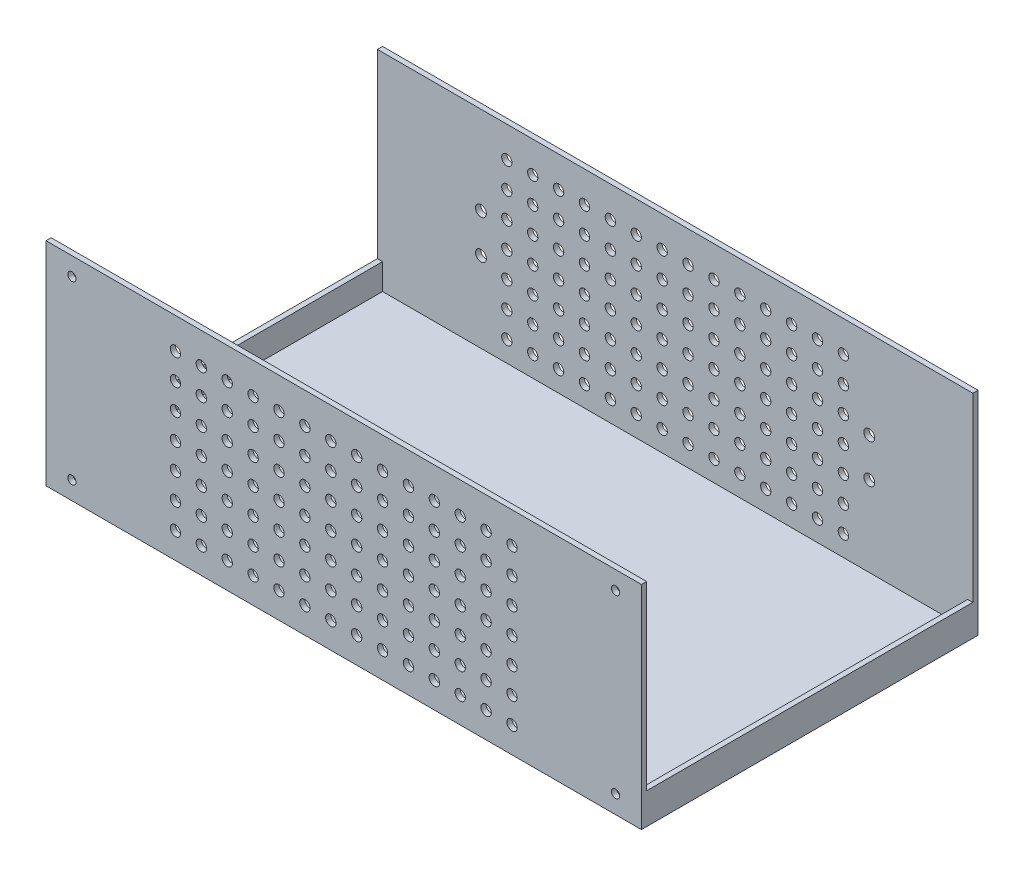
from build123d import *

# Parameters (mm, degrees)
SKETCH_1_W          = 230
SKETCH_1_H          = 130
EXTRUDE_1_DEPTH     = 2
SKETCH_2_W          = 230
SKETCH_2_H          = 130
SKETCH_2_W_2        = 226
SKETCH_2_H_2        = 126
EXTRUDE_2_DEPTH     = 10
SKETCH_3_W          = 230
SKETCH_3_H          = 2
EXTRUDE_3_DEPTH     = 70
SKETCH_4_R          = 3.1
CUT_EXTRUDE_1_DEPTH = 277.043474837
SKETCH_5_R          = 2.1
CUT_EXTRUDE_2_DEPTH = 10
SKETCH_6_R          = 2
CUT_EXTRUDE_3_DEPTH = 277.629716408
SKETCH_7_R          = 1.6
CUT_EXTRUDE_4_DEPTH = 10


with BuildPart() as part:
    # Эскиз1 → Бобышка-Вытянуть1 (new body)
    with BuildSketch(Plane(origin=(0, 0, 0), x_dir=(1, 0, 0), z_dir=(0, 1, 0))):
        with Locations((115, -65)):
            Rectangle(SKETCH_1_W, SKETCH_1_H)
    extrude(amount=EXTRUDE_1_DEPTH)

    # Эскиз2 → Бобышка-Вытянуть2 (add)
    with BuildSketch(Plane(origin=(0, 2, 0), x_dir=(1, 0, 0), z_dir=(0, 1, 0))):
        with Locations((115, -65)):
            Rectangle(SKETCH_2_W, SKETCH_2_H)
        with Locations((115, -65)):
            Rectangle(SKETCH_2_W_2, SKETCH_2_H_2, mode=Mode.SUBTRACT)
    extrude(amount=EXTRUDE_2_DEPTH)

    # Эскиз3 → Бобышка-Вытянуть3 (add)
    with BuildSketch(Plane(origin=(0, 12, 0), x_dir=(1, 0, 0), z_dir=(0, 1, 0))):
        with Locations((115, -1)):
            Rectangle(SKETCH_3_W, SKETCH_3_H)
        with Locations((115, -129)):
            Rectangle(SKETCH_3_W, SKETCH_3_H)
    extrude(amount=EXTRUDE_3_DEPTH)

    # Эскиз4 → Вырез-Вытянуть1 (cut, through all)
    with BuildSketch(Plane(origin=(0, 2, 0), x_dir=(1, 0, 0), z_dir=(0, 1, 0))):
        with Locations((113, -65)):
            Circle(SKETCH_4_R)
    extrude(amount=-CUT_EXTRUDE_1_DEPTH, mode=Mode.SUBTRACT)

    # Эскиз5 → Вырез-Вытянуть2 (cut)
    with BuildSketch(Plane(origin=(0, 0, 0), x_dir=(-1, 0, 0), z_dir=(0, 0, -1))):
        with Locations((-190, 48)):
            Circle(SKETCH_5_R)
        with Locations((-190, 33)):
            Circle(SKETCH_5_R)
        with Locations((-40, 48)):
            Circle(SKETCH_5_R)
        with Locations((-40, 33)):
            Circle(SKETCH_5_R)
    extrude(amount=-CUT_EXTRUDE_2_DEPTH, mode=Mode.SUBTRACT)

    # Эскиз6 → Вырез-Вытянуть3 (cut, through all)
    with BuildSketch(Plane(origin=(0, 0, 0), x_dir=(-1, 0, 0), z_dir=(0, 0, -1))):
        with Locations((-180, 70)):
            Circle(SKETCH_6_R)
        with Locations((-170, 70)):
            Circle(SKETCH_6_R)
        with Locations((-160, 70)):
            Circle(SKETCH_6_R)
        with Locations((-150, 70)):
            Circle(SKETCH_6_R)
        with Locations((-140, 70)):
            Circle(SKETCH_6_R)
        with Locations((-130, 70)):
            Circle(SKETCH_6_R)
        with Locations((-120, 70)):
            Circle(SKETCH_6_R)
        with Locations((-110, 70)):
            Circle(SKETCH_6_R)
        with Locations((-100, 70)):
            Circle(SKETCH_6_R)
        with Locations((-90, 70)):
            Circle(SKETCH_6_R)
        with Locations((-80, 70)):
            Circle(SKETCH_6_R)
        with Locations((-70, 70)):
            Circle(SKETCH_6_R)
        with Locations((-60, 70)):
            Circle(SKETCH_6_R)
        with Locations((-50, 70)):
            Circle(SKETCH_6_R)
        with Locations((-170, 60)):
            Circle(SKETCH_6_R)
        with Locations((-160, 60)):
            Circle(SKETCH_6_R)
        with Locations((-150, 60)):
            Circle(SKETCH_6_R)
        with Locations((-140, 60)):
            Circle(SKETCH_6_R)
        with Locations((-130, 60)):
            Circle(SKETCH_6_R)
        with Locations((-120, 60)):
            Circle(SKETCH_6_R)
        with Locations((-110, 60)):
            Circle(SKETCH_6_R)
        with Locations((-100, 60)):
            Circle(SKETCH_6_R)
        with Locations((-90, 60)):
            Circle(SKETCH_6_R)
        with Locations((-80, 60)):
            Circle(SKETCH_6_R)
        with Locations((-70, 60)):
            Circle(SKETCH_6_R)
        with Locations((-60, 60)):
            Circle(SKETCH_6_R)
        with Locations((-50, 60)):
            Circle(SKETCH_6_R)
        with Locations((-170, 50)):
            Circle(SKETCH_6_R)
        with Locations((-160, 50)):
            Circle(SKETCH_6_R)
        with Locations((-150, 50)):
            Circle(SKETCH_6_R)
        with Locations((-140, 50)):
            Circle(SKETCH_6_R)
        with Locations((-130, 50)):
            Circle(SKETCH_6_R)
        with Locations((-120, 50)):
            Circle(SKETCH_6_R)
        with Locations((-110, 50)):
            Circle(SKETCH_6_R)
        with Locations((-100, 50)):
            Circle(SKETCH_6_R)
        with Locations((-90, 50)):
            Circle(SKETCH_6_R)
        with Locations((-80, 50)):
            Circle(SKETCH_6_R)
        with Locations((-70, 50)):
            Circle(SKETCH_6_R)
        with Locations((-60, 50)):
            Circle(SKETCH_6_R)
        with Locations((-50, 50)):
            Circle(SKETCH_6_R)
        with Locations((-170, 40)):
            Circle(SKETCH_6_R)
        with Locations((-160, 40)):
            Circle(SKETCH_6_R)
        with Locations((-150, 40)):
            Circle(SKETCH_6_R)
        with Locations((-140, 40)):
            Circle(SKETCH_6_R)
        with Locations((-130, 40)):
            Circle(SKETCH_6_R)
        with Locations((-120, 40)):
            Circle(SKETCH_6_R)
        with Locations((-110, 40)):
            Circle(SKETCH_6_R)
        with Locations((-100, 40)):
            Circle(SKETCH_6_R)
        with Locations((-90, 40)):
            Circle(SKETCH_6_R)
        with Locations((-80, 40)):
            Circle(SKETCH_6_R)
        with Locations((-70, 40)):
            Circle(SKETCH_6_R)
        with Locations((-60, 40)):
            Circle(SKETCH_6_R)
        with Locations((-50, 40)):
            Circle(SKETCH_6_R)
        with Locations((-170, 30)):
            Circle(SKETCH_6_R)
        with Locations((-160, 30)):
            Circle(SKETCH_6_R)
        with Locations((-150, 30)):
            Circle(SKETCH_6_R)
        with Locations((-140, 30)):
            Circle(SKETCH_6_R)
        with Locations((-130, 30)):
            Circle(SKETCH_6_R)
        with Locations((-120, 30)):
            Circle(SKETCH_6_R)
        with Locations((-110, 30)):
            Circle(SKETCH_6_R)
        with Locations((-100, 30)):
            Circle(SKETCH_6_R)
        with Locations((-90, 30)):
            Circle(SKETCH_6_R)
        with Locations((-80, 30)):
            Circle(SKETCH_6_R)
        with Locations((-70, 30)):
            Circle(SKETCH_6_R)
        with Locations((-60, 30)):
            Circle(SKETCH_6_R)
        with Locations((-50, 30)):
            Circle(SKETCH_6_R)
        with Locations((-170, 20)):
            Circle(SKETCH_6_R)
        with Locations((-160, 20)):
            Circle(SKETCH_6_R)
        with Locations((-150, 20)):
            Circle(SKETCH_6_R)
        with Locations((-140, 20)):
            Circle(SKETCH_6_R)
        with Locations((-130, 20)):
            Circle(SKETCH_6_R)
        with Locations((-120, 20)):
            Circle(SKETCH_6_R)
        with Locations((-110, 20)):
            Circle(SKETCH_6_R)
        with Locations((-100, 20)):
            Circle(SKETCH_6_R)
        with Locations((-90, 20)):
            Circle(SKETCH_6_R)
        with Locations((-80, 20)):
            Circle(SKETCH_6_R)
        with Locations((-70, 20)):
            Circle(SKETCH_6_R)
        with Locations((-60, 20)):
            Circle(SKETCH_6_R)
        with Locations((-50, 20)):
            Circle(SKETCH_6_R)
        with Locations((-170, 10)):
            Circle(SKETCH_6_R)
        with Locations((-160, 10)):
            Circle(SKETCH_6_R)
        with Locations((-150, 10)):
            Circle(SKETCH_6_R)
        with Locations((-140, 10)):
            Circle(SKETCH_6_R)
        with Locations((-130, 10)):
            Circle(SKETCH_6_R)
        with Locations((-120, 10)):
            Circle(SKETCH_6_R)
        with Locations((-110, 10)):
            Circle(SKETCH_6_R)
        with Locations((-100, 10)):
            Circle(SKETCH_6_R)
        with Locations((-90, 10)):
            Circle(SKETCH_6_R)
        with Locations((-80, 10)):
            Circle(SKETCH_6_R)
        with Locations((-70, 10)):
            Circle(SKETCH_6_R)
        with Locations((-60, 10)):
            Circle(SKETCH_6_R)
        with Locations((-50, 10)):
            Circle(SKETCH_6_R)
        with Locations((-180, 60)):
            Circle(SKETCH_6_R)
        with Locations((-180, 50)):
            Circle(SKETCH_6_R)
        with Locations((-180, 40)):
            Circle(SKETCH_6_R)
        with Locations((-180, 30)):
            Circle(SKETCH_6_R)
        with Locations((-180, 20)):
            Circle(SKETCH_6_R)
        with Locations((-180, 10)):
            Circle(SKETCH_6_R)
    extrude(amount=-CUT_EXTRUDE_3_DEPTH, mode=Mode.SUBTRACT)

    # Эскиз7 → Вырез-Вытянуть4 (cut)
    with BuildSketch(Plane.XY.offset(130)):
        with Locations((10, 75)):
            Circle(SKETCH_7_R)
        with Locations((220, 75)):
            Circle(SKETCH_7_R)
        with Locations((220, 7)):
            Circle(SKETCH_7_R)
        with Locations((10, 7)):
            Circle(SKETCH_7_R)
    extrude(amount=-CUT_EXTRUDE_4_DEPTH, mode=Mode.SUBTRACT)


solid = part.part
